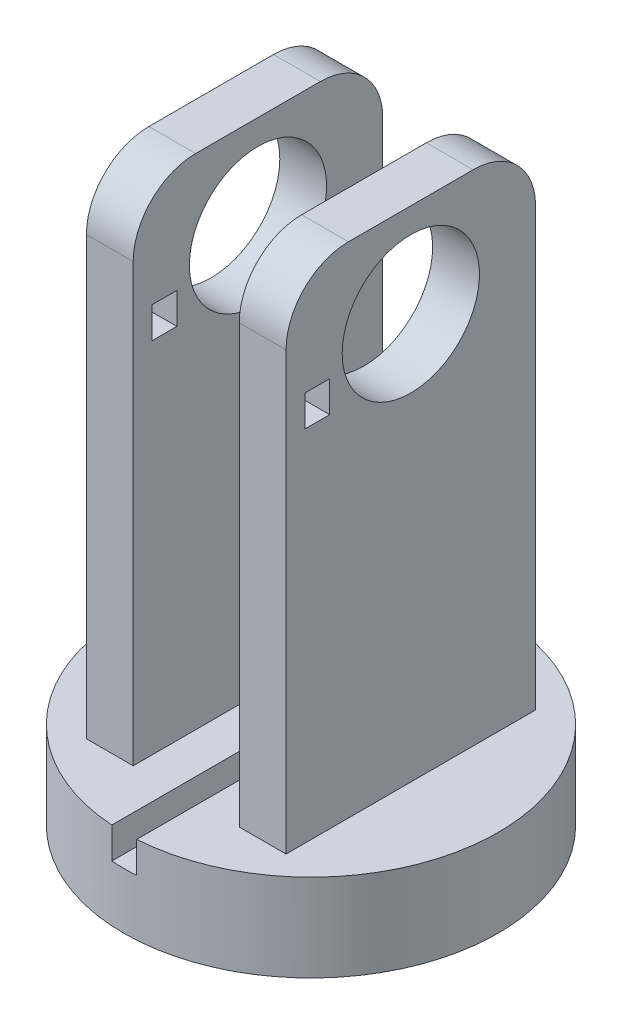
from build123d import *

# Parameters (mm, degrees)
SKETCH1_R               = 30
BOSS_EXTRUDE1_DEPTH     = 14
SKETCH2_R               = 11.05
CUT_EXTRUDE1_DEPTH      = 7
SKETCH5_W               = 7.5
SKETCH5_H               = 40
BOSS_EXTRUDE2_DEPTH     = 80
FILLET1_R               = 10
CUT_EXTRUDE3_DEPTH      = 109.866891202
CUT_EXTRUDE3_DEPTH_BACK = 109.866891202
SKETCH7_R               = 11
CUT_EXTRUDE4_START      = -5
CUT_EXTRUDE4_DEPTH      = 5
CUT_EXTRUDE5_REACH      = 110.867
SKETCH9_W               = 4
SKETCH9_H               = 5


with BuildPart() as part:
    # Sketch1 → Boss-Extrude1 (new body)
    with BuildSketch(Plane(origin=(0, 0, 0), x_dir=(1, 0, 0), z_dir=(0, 1, 0))):
        with Locations(Location((0, 0, 0), (0, 0, 90))):
            Circle(SKETCH1_R)
    extrude(amount=BOSS_EXTRUDE1_DEPTH)

    # Sketch2 → Cut-Extrude1 (cut)
    with BuildSketch(Plane.XZ):
        with Locations(Location((0, 0, 0), (0, 0, 270))):
            Circle(SKETCH2_R)
    extrude(amount=-CUT_EXTRUDE1_DEPTH, mode=Mode.SUBTRACT)

    # Sketch5 → Boss-Extrude2 (add)
    with BuildSketch(Plane(origin=(0, 14, 0), x_dir=(1, 0, 0), z_dir=(0, 1, 0))):
        with Locations((-12.25, 0)):
            Rectangle(SKETCH5_W, SKETCH5_H)
        with Locations((12.25, 0)):
            Rectangle(SKETCH5_W, SKETCH5_H)
    extrude(amount=BOSS_EXTRUDE2_DEPTH)

    # Fillet1
    fillet1_edges = [part.edges().sort_by_distance(p)[0] for p in [
        (-12.25, 94, 20),
        (-12.25, 94, -20),
        (12.25, 94, 20),
        (12.25, 94, -20),
    ]]
    fillet(fillet1_edges, radius=FILLET1_R)

    # Sketch7 → Cut-Extrude3 (cut, two sides: drawn at the far end of the back side and taken through both)
    with BuildSketch(Plane.ZY.offset(16).offset(-CUT_EXTRUDE3_DEPTH_BACK)):
        with Locations((0, 79)):
            Circle(SKETCH7_R)
    extrude(amount=CUT_EXTRUDE3_DEPTH + CUT_EXTRUDE3_DEPTH_BACK, mode=Mode.SUBTRACT)

    # Sketch8 → Cut-Extrude4 (cut)
    with BuildSketch(Plane(origin=(0, 14, 0), x_dir=(1, 0, 0), z_dir=(0, 1, 0)).offset(CUT_EXTRUDE4_START)):
        with BuildLine():
            Line((2, 29.933259094), (2, -29.933259094))
            ThreePointArc((2, -29.933259094), (0, -30), (-2, -29.933259094))
            Line((-2, -29.933259094), (-2, 29.933259094))
            ThreePointArc((-2, 29.933259094), (0, 30), (2, 29.933259094))
        make_face()
    extrude(amount=CUT_EXTRUDE4_DEPTH, mode=Mode.SUBTRACT)

    # Cut-Extrude5: up to this face of the body (flat: up to its plane)
    cut_extrude5_end = Plane(part.part.faces().sort_by_distance((16, 49.994067426, 0))[0])
    # Sketch9 → Cut-Extrude5 (cut, up to the picked face)
    with BuildSketch(Plane.ZY.offset(16), mode=Mode.PRIVATE) as cut_extrude5_sk1:
        with Locations((15, 74)):
            Rectangle(SKETCH9_W, SKETCH9_H)
    cut_extrude5_tool1 = split(extrude(cut_extrude5_sk1.sketch, amount=-CUT_EXTRUDE5_REACH, mode=Mode.PRIVATE), bisect_by=cut_extrude5_end, keep=Keep.BOTH, mode=Mode.PRIVATE)
    add(cut_extrude5_tool1.solids().sort_by(Axis((-16, 74, 15), (1, 0, 0)))[0], mode=Mode.SUBTRACT)


solid = part.part
